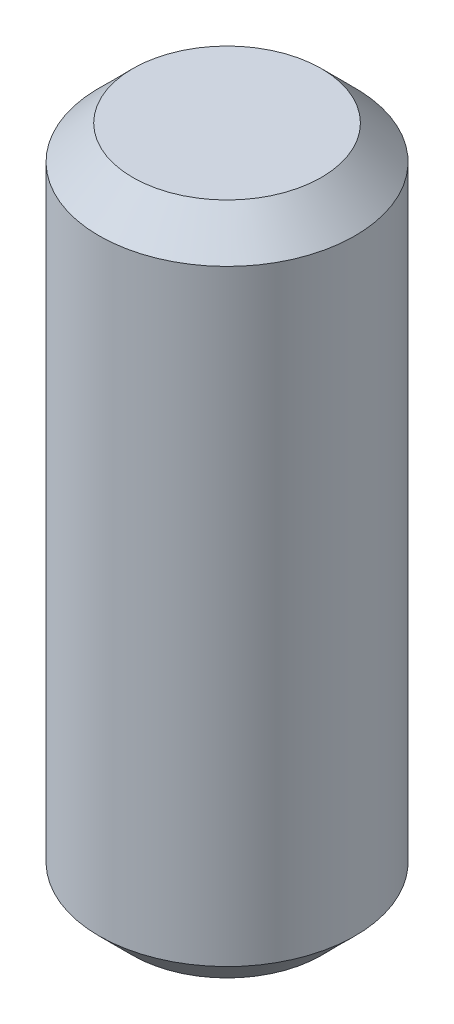
from build123d import *

# Parameters (mm, degrees)
SKETCH1_R           = 1.9
BOSS_EXTRUDE1_DEPTH = 10
CHAMFER1_SIZE       = 0.5
CHAMFER2_SIZE       = 0.5


with BuildPart() as part:
    # Sketch1 → Boss-Extrude1 (new body)
    with BuildSketch(Plane(origin=(0, 0, 0), x_dir=(1, 0, 0), z_dir=(0, 1, 0))):
        with Locations(Location((0, 0, 0), (0, 0, 270))):
            Circle(SKETCH1_R)
    extrude(amount=BOSS_EXTRUDE1_DEPTH)

    # Chamfer1
    chamfer1_edges = [part.edges().sort_by_distance(p)[0] for p in [
        (0, 0, -1.9),
    ]]
    chamfer(chamfer1_edges, length=CHAMFER1_SIZE)

    # Chamfer2
    chamfer2_edges = [part.edges().sort_by_distance(p)[0] for p in [
        (0, 10, -1.9),
    ]]
    chamfer(chamfer2_edges, length=CHAMFER2_SIZE)


solid = part.part
